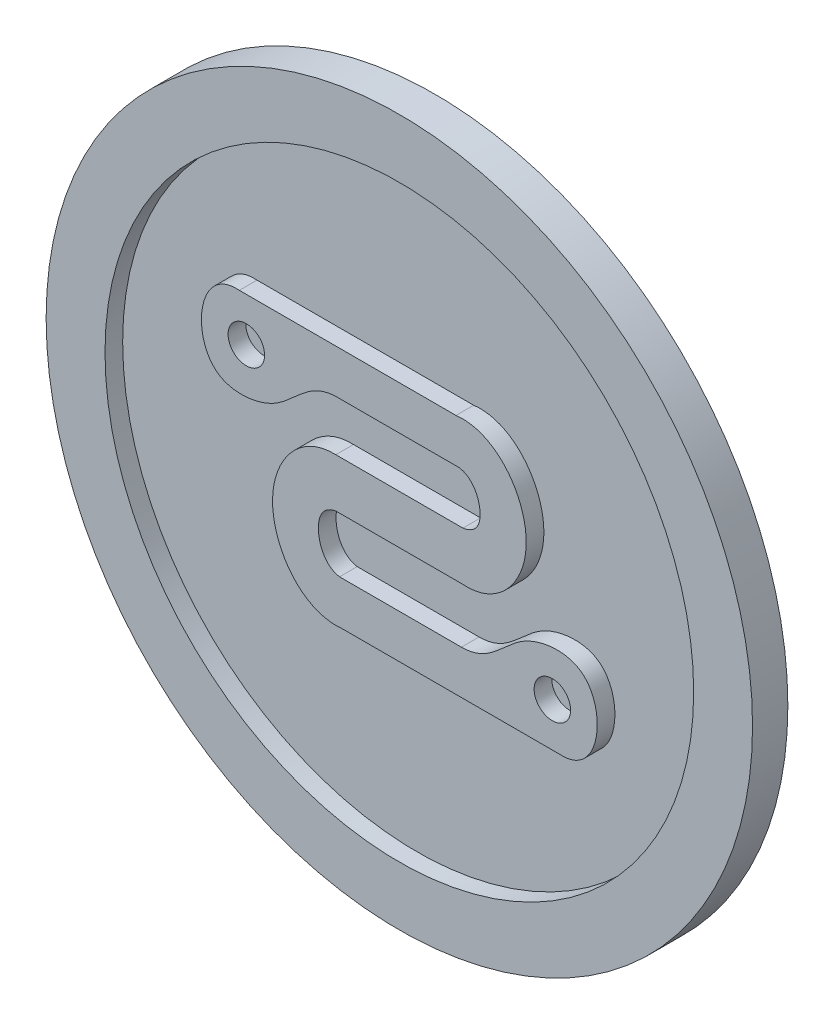
from build123d import *

# Parameters (mm, degrees)
SZKIC2_R                    = 15
DODANIE_WYCI_GNI_CIE1_DEPTH = 1.5
SZKIC3_R                    = 30
DODANIE_WYCI_GNI_CIE2_DEPTH = 1.5
SZKIC4_R                    = 1.549896932
DODANIE_WYCI_GNI_CIE3_DEPTH = 1.5
SZKIC5_R                    = 30
SZKIC5_R_2                  = 25
DODANIE_WYCI_GNI_CIE4_DEPTH = 1.5


with BuildPart() as part:
    # Szkic2 → Dodanie-wyciągnięcie1 (new body)
    with BuildSketch(Plane.XY):
        Circle(SZKIC2_R)
    extrude(amount=DODANIE_WYCI_GNI_CIE1_DEPTH)

    # Szkic3 → Dodanie-wyciągnięcie2 (add)
    with BuildSketch(Plane.XY.offset(1.5)):
        Circle(SZKIC3_R)
    extrude(amount=DODANIE_WYCI_GNI_CIE2_DEPTH)

    # Szkic4 → Dodanie-wyciągnięcie3 (add)
    with BuildSketch(Plane.XY.offset(3)):
        with BuildLine():
            Line((4.812477136, 10.260072193), (-13.590223768, 10.260072193))
            add(Edge.make_bspline(
                [(-13.590223768, 10.260072193), (-17.118745335, 10.525910667), (-18.036890573, 2.046692384), (-9.462596481, 2.827097674), (-7.837333483, 6.548859819), (-5.272128066, 6.55590597)],
                knots=[0, 0, 0, 0, 0.432020753, 0.673133157, 1, 1, 1, 1], degree=3))
            Line((-5.272128066, 6.55590597), (5.077687391, 6.55590597))
            add(Edge.make_bspline(
                [(5.400788266, 2.266678597), (6.693166153, 2.459988983), (7.256310662, 4.478210573), (6.099978239, 6.399808673), (5.077687391, 6.55590597)],
                knots=[0, 0, 0, 0, 0.494793037, 1, 1, 1, 1], degree=3))
            Line((5.400788266, 2.266678597), (-5.393615059, 2.266678597))
            add(Edge.make_bspline(
                [(-4.812477136, -10.260072193), (-8.43662289, -10.67337056), (-13.131808051, -3.70534385), (-8.393582508, 2.373047437), (-5.393615059, 2.266678597)],
                knots=[0, 0, 0, 0, 0.544342745, 1, 1, 1, 1], degree=3))
            Line((-4.812477136, -10.260072193), (13.590223768, -10.260072193))
            add(Edge.make_bspline(
                [(13.590223768, -10.260072193), (17.118745335, -10.525910667), (18.036890573, -2.046692384), (9.462596481, -2.827097674), (7.837333483, -6.548859819), (5.272128066, -6.55590597)],
                knots=[0, 0, 0, 0, 0.432020753, 0.673133157, 1, 1, 1, 1], degree=3))
            Line((5.272128066, -6.55590597), (-5.077687391, -6.55590597))
            add(Edge.make_bspline(
                [(-5.393615059, -1.873220172), (-6.707130139, -2.111629026), (-7.285258718, -4.388625667), (-6.108553028, -6.392911018), (-5.077687391, -6.55590597)],
                knots=[0, 0, 0, 0, 0.526459521, 1, 1, 1, 1], degree=3))
            Line((-5.393615059, -1.873220172), (5.400788266, -1.873220172))
            add(Edge.make_bspline(
                [(4.812477136, 10.260072193), (8.408712031, 10.687954055), (13.196256947, 3.738137397), (8.332970423, -2.090379005), (5.400788266, -1.873220172)],
                knots=[0, 0, 0, 0, 0.552476507, 1, 1, 1, 1], degree=3))
        make_face()
        with Locations((-12.996205696, 6.55590597)):
            Circle(SZKIC4_R, mode=Mode.SUBTRACT)
        with Locations((12.996205696, -6.55590597)):
            Circle(SZKIC4_R, mode=Mode.SUBTRACT)
    extrude(amount=DODANIE_WYCI_GNI_CIE3_DEPTH)

    # Szkic5 → Dodanie-wyciągnięcie4 (add)
    with BuildSketch(Plane.XY.offset(3)):
        Circle(SZKIC5_R)
        Circle(SZKIC5_R_2, mode=Mode.SUBTRACT)
    extrude(amount=DODANIE_WYCI_GNI_CIE4_DEPTH)


solid = part.part
